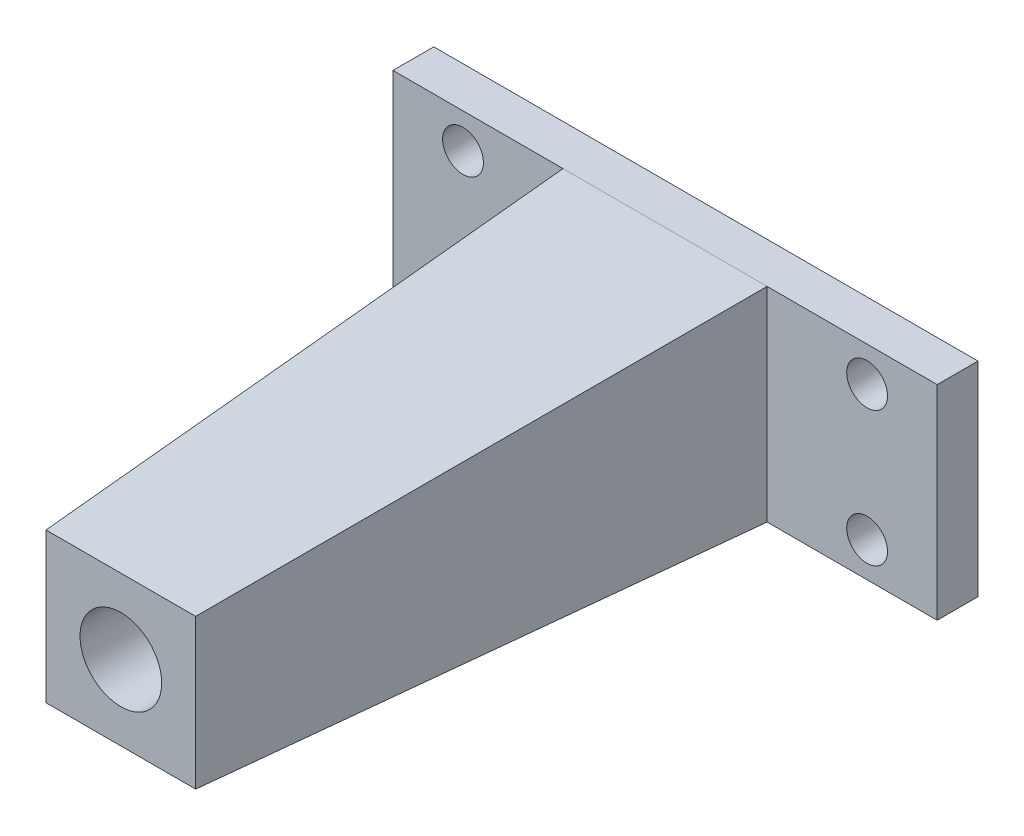
from build123d import *

# Parameters (mm, degrees)
SKETCH_1_W          = 40
SKETCH_1_H          = 15
SKETCH_1_R          = 1.5
EXTRUDE_1_DEPTH     = 3
SKETCH_5_R          = 1.5
CUT_EXTRUDE_3_DEPTH = 8
SKETCH_8_R          = 2.999642866
CUT_EXTRUDE_4_DEPTH = 15
SKETCH_9_R          = 1.5
CUT_EXTRUDE_5_DEPTH = 15


with BuildPart() as part:
    # 草图1 → 凸台-拉伸1 (new body)
    with BuildSketch(Plane.XY):
        Rectangle(SKETCH_1_W, SKETCH_1_H)
        with Locations((4.95, 4.95)):
            Circle(SKETCH_1_R, mode=Mode.SUBTRACT)
        with Locations((4.95, -4.95)):
            Circle(SKETCH_1_R, mode=Mode.SUBTRACT)
        with Locations((-4.95, -4.95)):
            Circle(SKETCH_1_R, mode=Mode.SUBTRACT)
        with Locations((-4.95, 4.95)):
            Circle(SKETCH_1_R, mode=Mode.SUBTRACT)
    extrude(amount=EXTRUDE_1_DEPTH)

    # 草图3 → 放样1 section 0
    with BuildSketch(Plane.XY.offset(43)):
        with BuildLine():
            Line((-5.5, -5.5), (5.5, -5.5))
            Line((5.5, -5.5), (5.5, 5.5))
            Line((5.5, 5.5), (-5.5, 5.5))
            Line((-5.5, 5.5), (-5.5, -5.5))
        make_face()
    # 草图2 → 放样1 section 1
    with BuildSketch(Plane.XY.offset(3)):
        with BuildLine():
            Line((-7.5, -7.5), (7.5, -7.5))
            Line((7.5, -7.5), (7.5, 7.5))
            Line((7.5, 7.5), (-7.5, 7.5))
            Line((-7.5, 7.5), (-7.5, -7.5))
        make_face()
    loft()

    # 草图5 → 切除-拉伸3 (cut)
    with BuildSketch(Plane(origin=(0, 0, 0), x_dir=(-1, 0, 0), z_dir=(0, 0, -1))):
        with Locations((4.95, -4.95)):
            Circle(SKETCH_5_R)
        with Locations((4.95, 4.95)):
            Circle(SKETCH_5_R)
        with Locations((-4.95, 4.95)):
            Circle(SKETCH_5_R)
        with Locations((-4.95, -4.95)):
            Circle(SKETCH_5_R)
    extrude(amount=-CUT_EXTRUDE_3_DEPTH, mode=Mode.SUBTRACT)

    # 草图8 → 切除-拉伸4 (cut)
    with BuildSketch(Plane.XY.offset(43)):
        Circle(SKETCH_8_R)
    extrude(amount=-CUT_EXTRUDE_4_DEPTH, mode=Mode.SUBTRACT)

    # 草图9 → 切除-拉伸5 (cut)
    with BuildSketch(Plane(origin=(0, 0, 0), x_dir=(-1, 0, 0), z_dir=(0, 0, -1))):
        with Locations((-14.848989873, -4.95)):
            Circle(SKETCH_9_R)
        with Locations((-14.848989873, 4.949494937)):
            Circle(SKETCH_9_R)
        with Locations((14.849494937, 4.949494937)):
            Circle(SKETCH_9_R)
        with Locations((14.849494937, -4.95)):
            Circle(SKETCH_9_R)
    extrude(amount=-CUT_EXTRUDE_5_DEPTH, mode=Mode.SUBTRACT)


solid = part.part
